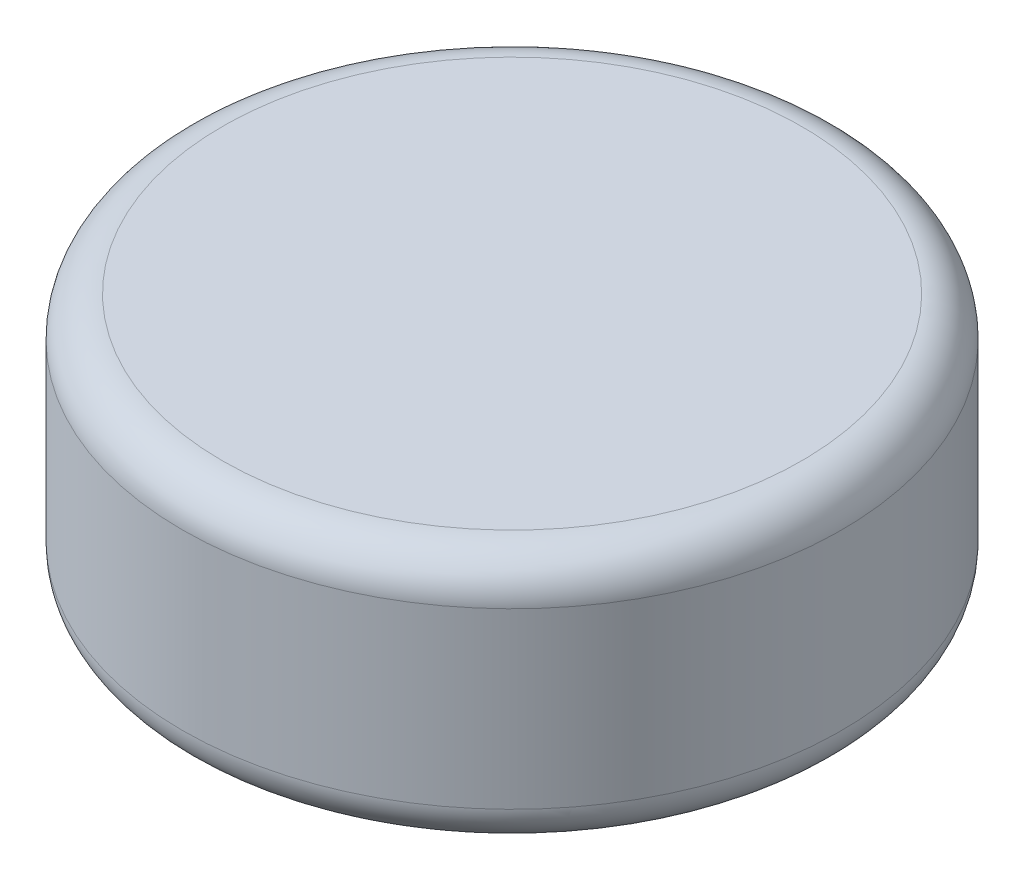
from build123d import *

# Parameters (mm, degrees)
SCHIZZO1_R                   = 330.2
ESTRUSIONE_ESTRUSIONE1_DEPTH = 254
RACCORDO1_R                  = 40


with BuildPart() as part:
    # Schizzo1 → Estrusione-Estrusione1 (new body)
    with BuildSketch(Plane(origin=(0, 0, 0), x_dir=(-1, 0, 0), z_dir=(0, 1, 0))):
        with Locations(Location((0, 0, 0), (0, 0, 90))):
            Circle(SCHIZZO1_R)
    extrude(amount=ESTRUSIONE_ESTRUSIONE1_DEPTH)

    # Raccordo1
    raccordo1_edges = [part.edges().sort_by_distance(p)[0] for p in [
        (0, 0, -330.2),
        (0, 254, -330.2),
    ]]
    fillet(raccordo1_edges, radius=RACCORDO1_R)


solid = part.part
